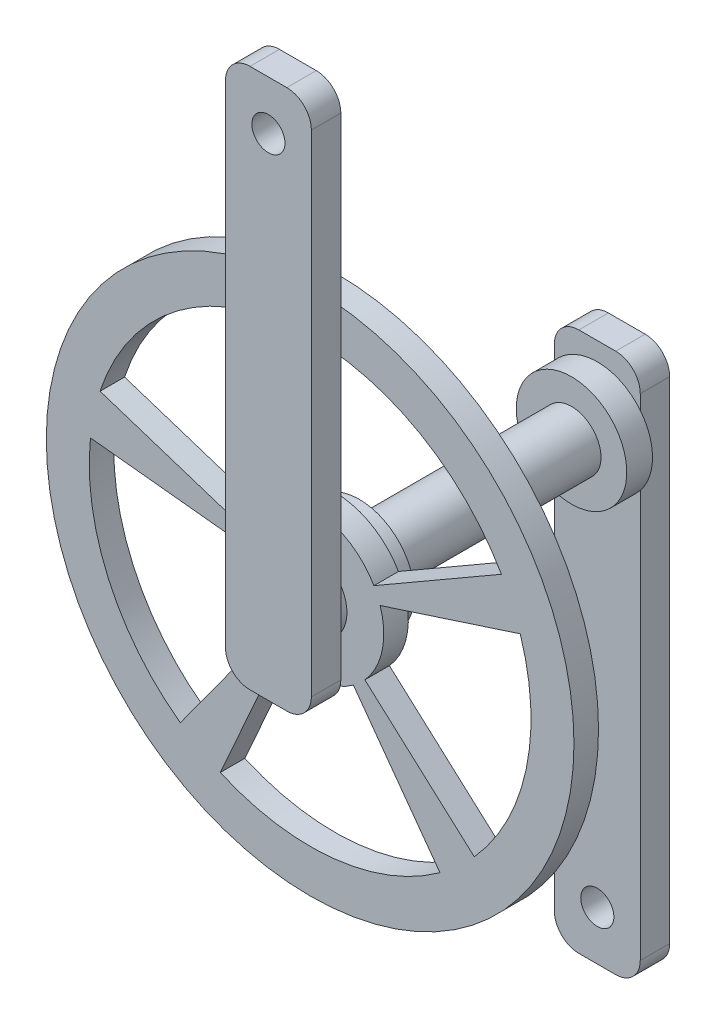
from build123d import *

# Parameters (mm, degrees)
BOSS_EXTRUDE1_DEPTH      = 36
BOSS_EXTRUDE1_DEPTH_BACK = 50.5
SKETCH1_R                = 12
SKETCH6_R                = 22.5
BOSS_EXTRUDE6_DEPTH      = 10.5
BOSS_EXTRUDE7_START      = 10
SKETCH7_R                = 22.5
BOSS_EXTRUDE7_DEPTH      = 10
SKETCH2_R                = 6.75
BOSS_EXTRUDE2_DEPTH      = 12
SKETCH3_R                = 107.5
BOSS_EXTRUDE3_DEPTH      = 10
SKETCH5_R                = 15
BOSS_EXTRUDE5_DEPTH      = 5
SKETCH4_R                = 6.75
BOSS_EXTRUDE4_DEPTH      = 12


with BuildPart() as part:
    # Sketch1 → Boss-Extrude1 (new, two sides: drawn at the far end of the back side and taken through both)
    with BuildSketch(Plane.XY.offset(-BOSS_EXTRUDE1_DEPTH_BACK)):
        Circle(SKETCH1_R)
    extrude(amount=BOSS_EXTRUDE1_DEPTH + BOSS_EXTRUDE1_DEPTH_BACK)

    # Sketch6 → Boss-Extrude6 (add)
    with BuildSketch(Plane(origin=(0, 0, -50.5), x_dir=(-1, 0, 0), z_dir=(0, 0, -1))):
        with Locations(Location((0, 0, 0), (0, 0, 180))):
            Circle(SKETCH6_R)
    extrude(amount=BOSS_EXTRUDE6_DEPTH)

    # Sketch7 → Boss-Extrude7 (add)
    with BuildSketch(Plane.XY.offset(36).offset(BOSS_EXTRUDE7_START)):
        Circle(SKETCH7_R)
    extrude(amount=-BOSS_EXTRUDE7_DEPTH)

    # Sketch2 → Boss-Extrude2 (add)
    with BuildSketch(Plane(origin=(0, 0, -61), x_dir=(-1, 0, 0), z_dir=(0, 0, -1))):
        with BuildLine():
            Line((-7.5, -190), (7.5, -190))
            ThreePointArc((7.5, -190), (14.571067812, -187.071067812), (17.5, -180))
            Line((17.5, -180), (17.5, 20))
            ThreePointArc((17.5, 20), (14.571067812, 27.071067812), (7.5, 30))
            Line((7.5, 30), (-7.5, 30))
            ThreePointArc((-7.5, 30), (-14.571067812, 27.071067812), (-17.5, 20))
            Line((-17.5, 20), (-17.5, -180))
            ThreePointArc((-17.5, -180), (-14.571067812, -187.071067812), (-7.5, -190))
        make_face()
        with Locations((0, -170)):
            Circle(SKETCH2_R, mode=Mode.SUBTRACT)
    extrude(amount=BOSS_EXTRUDE2_DEPTH)

    # Sketch3 → Boss-Extrude3 (add)
    with BuildSketch(Plane.XY.offset(46)):
        Circle(SKETCH3_R)
        with BuildLine():
            Line((0, 30), (0, 90))
            ThreePointArc((0, 90), (45, 77.942286341), (77.942286341, 45))
            Line((77.942286341, 45), (25.980762114, 15))
            ThreePointArc((25.980762114, 15), (15, 25.980762114), (0, 30))
        make_face(mode=Mode.SUBTRACT)
        with BuildLine():
            Line((28.531695489, 9.270509831), (85.595086467, 27.811529494))
            ThreePointArc((85.595086467, 27.811529494), (88.033284066, -18.712052174), (66.883034293, -60.221754572))
            Line((66.883034293, -60.221754572), (22.294344764, -20.073918191))
            ThreePointArc((22.294344764, -20.073918191), (29.344428022, -6.237350725), (28.531695489, 9.270509831))
        make_face(mode=Mode.SUBTRACT)
        with BuildLine():
            Line((17.633557569, -24.270509831), (52.900672706, -72.811529494))
            ThreePointArc((52.900672706, -72.811529494), (9.407561694, -89.506970583), (-36.606297877, -82.219091188))
            Line((-36.606297877, -82.219091188), (-12.202099292, -27.406363729))
            ThreePointArc((-12.202099292, -27.406363729), (3.135853898, -29.835656861), (17.633557569, -24.270509831))
        make_face(mode=Mode.SUBTRACT)
        with BuildLine():
            Line((-17.633557569, -24.270509831), (-52.900672706, -72.811529494))
            ThreePointArc((-52.900672706, -72.811529494), (-82.219091188, -36.606297877), (-89.506970583, 9.407561694))
            Line((-89.506970583, 9.407561694), (-29.835656861, 3.135853898))
            ThreePointArc((-29.835656861, 3.135853898), (-27.406363729, -12.202099292), (-17.633557569, -24.270509831))
        make_face(mode=Mode.SUBTRACT)
        with BuildLine():
            Line((-28.531695489, 9.270509831), (-85.595086467, 27.811529494))
            ThreePointArc((-85.595086467, 27.811529494), (-60.221754572, 66.883034293), (-18.712052174, 88.033284066))
            Line((-18.712052174, 88.033284066), (-6.237350725, 29.344428022))
            ThreePointArc((-6.237350725, 29.344428022), (-20.073918191, 22.294344764), (-28.531695489, 9.270509831))
        make_face(mode=Mode.SUBTRACT)
    extrude(amount=BOSS_EXTRUDE3_DEPTH)

    # Sketch5 → Boss-Extrude5 (add)
    with BuildSketch(Plane.XY.offset(56)):
        Circle(SKETCH5_R)
    extrude(amount=BOSS_EXTRUDE5_DEPTH)

    # Sketch4 → Boss-Extrude4 (add)
    with BuildSketch(Plane.XY.offset(61)):
        with BuildLine():
            Line((-7.5, -30), (7.5, -30))
            ThreePointArc((7.5, -30), (14.571067812, -27.071067812), (17.5, -20))
            Line((17.5, -20), (17.5, 180))
            ThreePointArc((17.5, 180), (14.571067812, 187.071067812), (7.5, 190))
            Line((7.5, 190), (-7.5, 190))
            ThreePointArc((-7.5, 190), (-14.571067812, 187.071067812), (-17.5, 180))
            Line((-17.5, 180), (-17.5, -20))
            ThreePointArc((-17.5, -20), (-14.571067812, -27.071067812), (-7.5, -30))
        make_face()
        with Locations((0, 170)):
            Circle(SKETCH4_R, mode=Mode.SUBTRACT)
    extrude(amount=BOSS_EXTRUDE4_DEPTH)


solid = part.part
